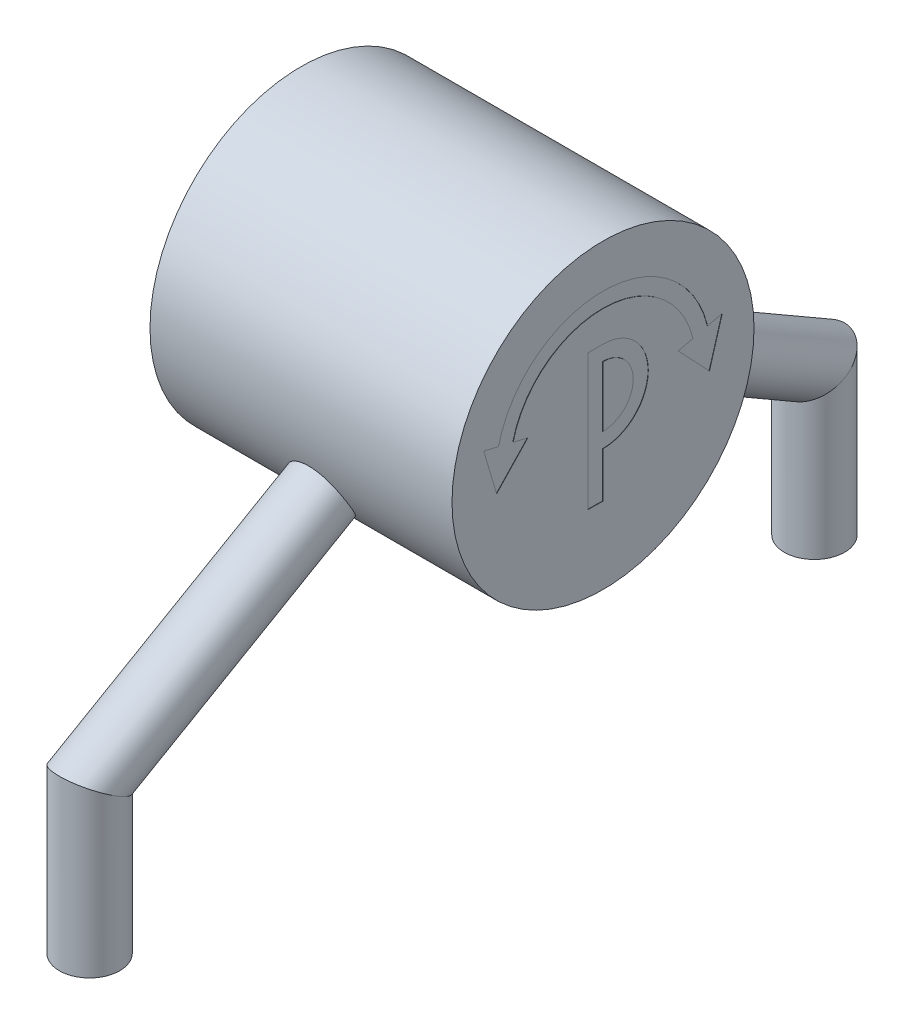
from build123d import *

# Parameters (mm, degrees)
SKETCH1_R           = 50
BOSS_EXTRUDE1_DEPTH = 50
SWEEP1_PROFILE_R    = 10
CUT_EXTRUDE1_DEPTH  = 0.1


with BuildPart() as part:
    # Sketch1 → Boss-Extrude1 (new, symmetric)
    with BuildSketch(Plane(origin=(0, 0, 0), x_dir=(0, 0, -1), z_dir=(1, 0, 0))):
        Circle(SKETCH1_R)
    extrude(amount=BOSS_EXTRUDE1_DEPTH, both=True)

    # Sweep1: sweep along a path in Sketch2
    with BuildLine(Plane(origin=(0, 0, 0), x_dir=(0, 0, -1), z_dir=(1, 0, 0))) as sweep1_path:
        Line((0, 0), (-120, -69.282032303))
        Line((-120, -69.282032303), (-120, -119.282032303))
    # Sweep1 profile (on start of the path) → Sweep1 (sweep)
    with BuildSketch(Plane(origin=(0, 0, 0), x_dir=(0, 0.866025403784438, 0.5000000000000012), z_dir=(0, -0.5000000000000012, 0.866025403784438))):
        Circle(SWEEP1_PROFILE_R)
    sweep1 = sweep(path=sweep1_path.line, transition=Transition.RIGHT)

    # Mirror1: Sweep1 across plane
    add(sweep1.mirror(Plane.XY))

    # Sketch13 → Cut-Extrude1 (cut)
    # profile 1 of 2: a face of its own
    with BuildSketch(Plane(origin=(50, 0, 0), x_dir=(0, 0, -1), z_dir=(1, 0, 0))):
        with BuildLine():
            Line((-34.63127072, 8.321411489), (-39.492891462, 9.489591167))
            Line((-39.492891462, 9.489591167), (-35.235480182, -4.893539549))
            Line((-35.235480182, -4.893539549), (-24.908029236, 5.985052132))
            Line((-24.908029236, 5.985052132), (-29.769649978, 7.15323181))
            ThreePointArc((-29.769649978, 7.15323181), (0, 30.61700157), (29.769649978, 7.15323181))
            Line((29.769649978, 7.15323181), (24.908029236, 5.985052132))
            Line((24.908029236, 5.985052132), (35.235480182, -4.893539549))
            Line((35.235480182, -4.893539549), (39.492891462, 9.489591167))
            Line((39.492891462, 9.489591167), (34.63127072, 8.321411489))
            ThreePointArc((34.63127072, 8.321411489), (0, 35.61700157), (-34.63127072, 8.321411489))
        make_face()
    # profile 2 of 2: a face of its own
    with BuildSketch(Plane(origin=(50, 0, 0), x_dir=(0, 0, -1), z_dir=(1, 0, 0))):
        with BuildLine():
            Line((-5, 20.386275511), (-5, -24.532723242))
            ThreePointArc((-5, -24.532723242), (-2.499671961, -24.552974882), (0, -24.613724489))
            Line((0, -24.613724489), (0, -9.613724489))
            ThreePointArc((0, -9.613724489), (15, 5.386275511), (0, 20.386275511))
            Line((0, 20.386275511), (-5, 20.386275511))
        make_face()
        with BuildLine():
            Line((0, 15.386275511), (0, -4.613724489))
            ThreePointArc((0, -4.613724489), (10, 5.386275511), (0, 15.386275511))
        make_face(mode=Mode.SUBTRACT)
    extrude(amount=-CUT_EXTRUDE1_DEPTH, mode=Mode.SUBTRACT)


solid = part.part
